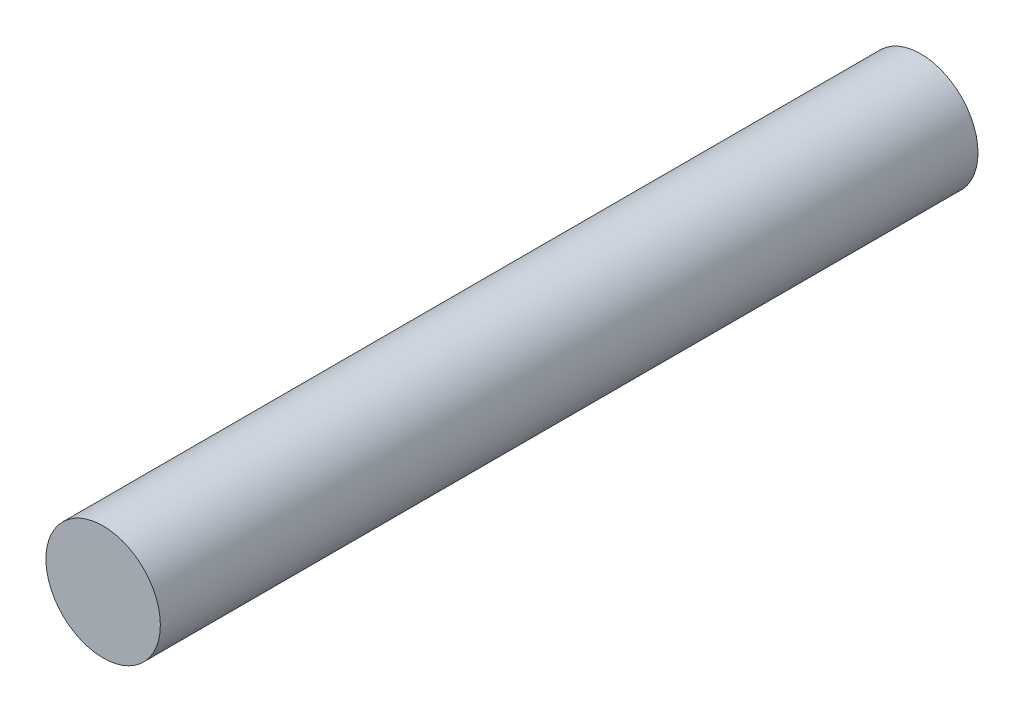
from build123d import *

# Parameters (mm, degrees)
SKETCH1_R           = 7
BOSS_EXTRUDE1_DEPTH = 100


with BuildPart() as part:
    # Sketch1 → Boss-Extrude1 (new body)
    with BuildSketch(Plane.XY):
        Circle(SKETCH1_R)
    extrude(amount=BOSS_EXTRUDE1_DEPTH)


solid = part.part
